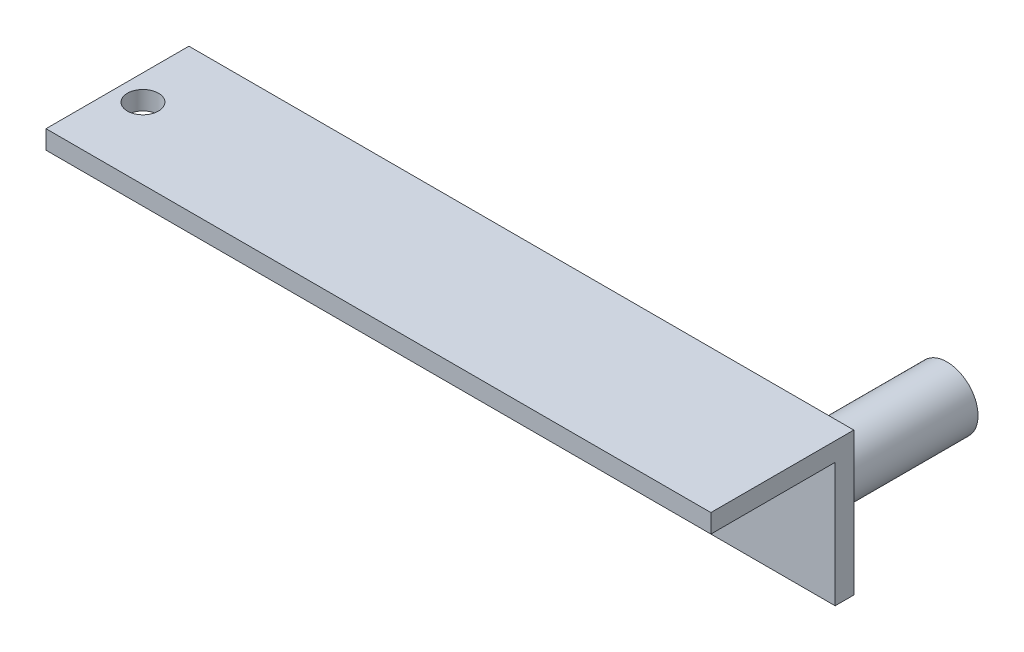
from build123d import *

# Parameters (mm, degrees)
SKETCH1_W           = 20
SKETCH1_H           = 23
BOSS_EXTRUDE1_DEPTH = 3
SKETCH2_W           = 20
SKETCH2_H           = 3
BOSS_EXTRUDE2_DEPTH = 20
SKETCH3_R           = 5
BOSS_EXTRUDE3_DEPTH = 25
SKETCH4_R           = 3
CUT_EXTRUDE1_DEPTH  = 25
SKETCH5_W           = 23
SKETCH5_H           = 3
BOSS_EXTRUDE4_DEPTH = 87
SKETCH6_R           = 2.5
CUT_EXTRUDE2_DEPTH  = 3


with BuildPart() as part:
    # Sketch1 → Boss-Extrude1 (new body)
    with BuildSketch(Plane.XY):
        with Locations((10, -11.5)):
            Rectangle(SKETCH1_W, SKETCH1_H)
    extrude(amount=BOSS_EXTRUDE1_DEPTH)

    # Sketch2 → Boss-Extrude2 (add)
    with BuildSketch(Plane.XY.offset(3)):
        with Locations((10, -1.5)):
            Rectangle(SKETCH2_W, SKETCH2_H)
    extrude(amount=BOSS_EXTRUDE2_DEPTH)

    # Sketch3 → Boss-Extrude3 (add)
    with BuildSketch(Plane(origin=(0, 0, 0), x_dir=(-1, 0, 0), z_dir=(0, 0, -1))):
        with Locations((-10, -13)):
            Circle(SKETCH3_R)
    extrude(amount=BOSS_EXTRUDE3_DEPTH)

    # Sketch4 → Cut-Extrude1 (cut)
    with BuildSketch(Plane(origin=(0, 0, -25), x_dir=(-1, 0, 0), z_dir=(0, 0, -1))):
        with Locations((-10, -13)):
            Circle(SKETCH4_R)
    extrude(amount=-CUT_EXTRUDE1_DEPTH, mode=Mode.SUBTRACT)

    # Sketch5 → Boss-Extrude4 (add)
    with BuildSketch(Plane.ZY):
        with Locations((11.5, -1.5)):
            Rectangle(SKETCH5_W, SKETCH5_H)
    extrude(amount=BOSS_EXTRUDE4_DEPTH)

    # Sketch6 → Cut-Extrude2 (cut)
    with BuildSketch(Plane(origin=(0, 0, 0), x_dir=(1, 0, 0), z_dir=(0, 1, 0))):
        with Locations(Location((-82.9, -11.5, 0), (0, 0, 270))):
            Circle(SKETCH6_R)
    extrude(amount=-CUT_EXTRUDE2_DEPTH, mode=Mode.SUBTRACT)


solid = part.part
